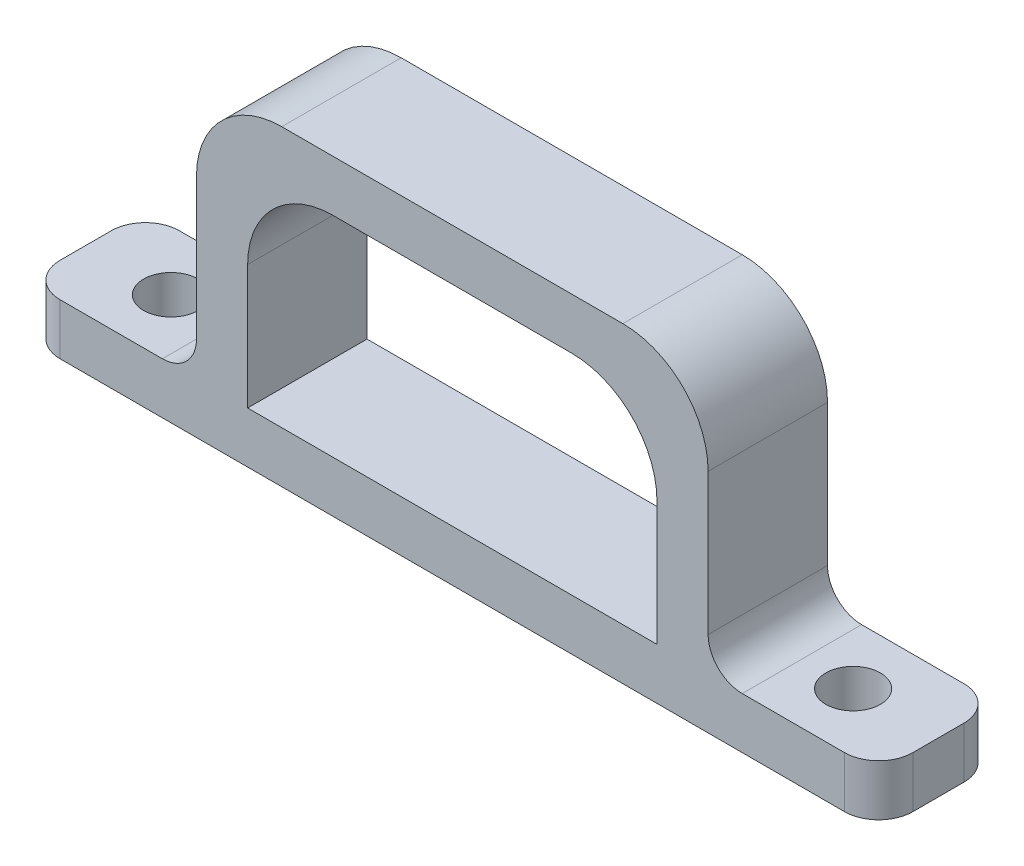
from build123d import *

# Parameters (mm, degrees)
BOSS_EXTRUDE1_DEPTH = 7
SKETCH3_R           = 1.6
CUT_EXTRUDE1_DEPTH  = 7
FILLET1_R           = 5
FILLET2_R           = 2


with BuildPart() as part:
    # Sketch2 → Boss-Extrude1 (new body)
    with BuildSketch(Plane.XY):
        Polygon((-25, 1.5), (-25, -1.5), (25, -1.5), (25, 1.5), (15, 1.5), (12, 1.5), (-12, 1.5), (-15, 1.5), align=None)
        Polygon((-15, 16.783591394), (-15, 1.5), (-12, 1.5), (-12, 13.783591394), (12, 13.783591394), (12, 1.5), (15, 1.5), (15, 16.783591394), align=None)
    extrude(amount=BOSS_EXTRUDE1_DEPTH)

    # Sketch3 → Cut-Extrude1 (cut)
    with BuildSketch(Plane(origin=(0, 1.5, 0), x_dir=(1, 0, 0), z_dir=(0, 1, 0))):
        with Locations(Location((-20, -3.5, 0), (0, 0, 270))):
            Circle(SKETCH3_R)
        with Locations(Location((20, -3.5, 0), (0, 0, 270))):
            Circle(SKETCH3_R)
    extrude(amount=-CUT_EXTRUDE1_DEPTH, mode=Mode.SUBTRACT)

    # Fillet1
    fillet1_edges = [part.edges().sort_by_distance(p)[0] for p in [
        (-15, 16.783591394, 3.5),
        (15, 16.783591394, 3.5),
        (12, 13.783591394, 3.5),
        (-12, 13.783591394, 3.5),
    ]]
    fillet(fillet1_edges, radius=FILLET1_R)

    # Fillet2
    fillet2_edges = [part.edges().sort_by_distance(p)[0] for p in [
        (-25, 0, 0),
        (25, 0, 0),
        (-15, 1.5, 3.5),
        (15, 1.5, 3.5),
        (25, 0, 7),
        (-25, 0, 7),
    ]]
    fillet(fillet2_edges, radius=FILLET2_R)


solid = part.part
